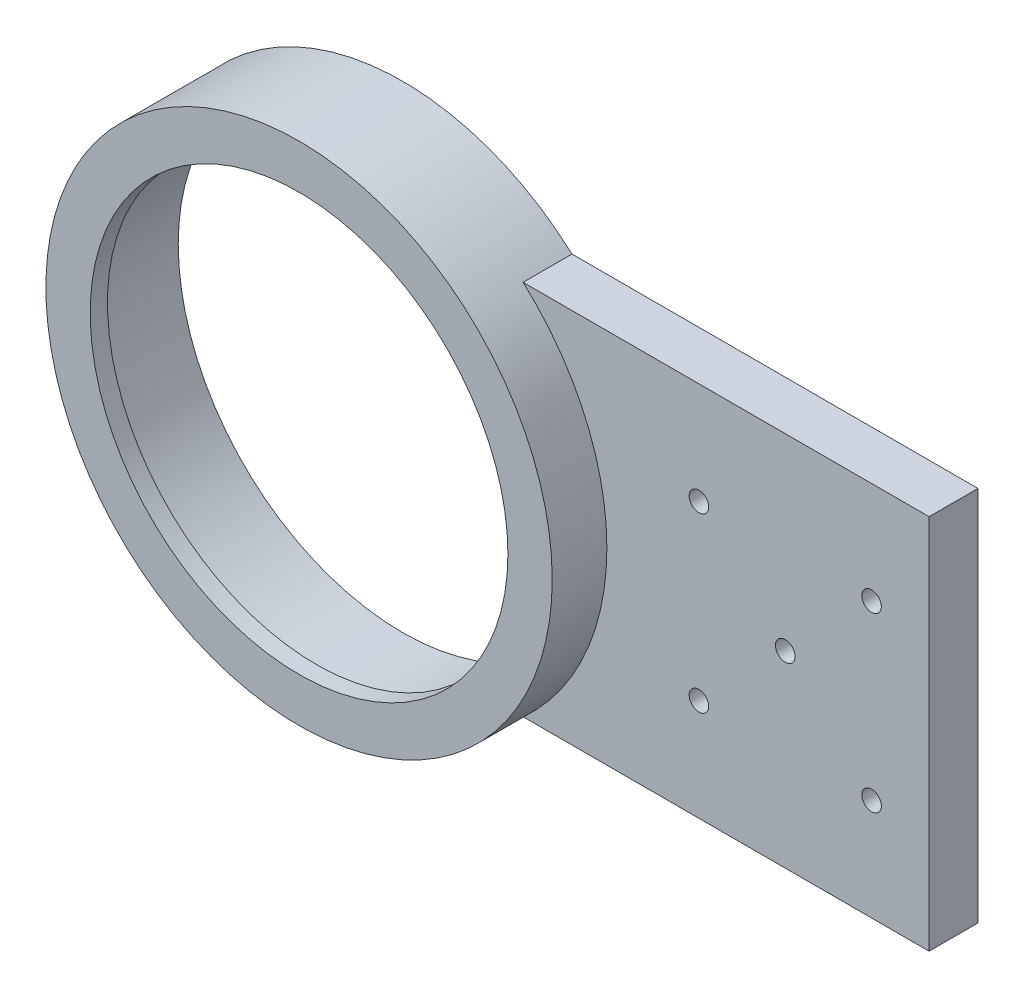
from build123d import *

# Parameters (mm, degrees)
CROQUIS1_R                   = 44
CROQUIS1_R_2                 = 36.3
SALIENTE_EXTRUIR1_DEPTH      = 3
SALIENTE_EXTRUIR2_START      = 15
CROQUIS2_R                   = 44
CROQUIS2_R_2                 = 39
SALIENTE_EXTRUIR2_DEPTH      = 15
SALIENTE_EXTRUIR3_DEPTH      = 8.5
TALADRO_DE_MARGEN_PARA_M31_D = 3.4


with BuildPart() as part:
    # Croquis1 → Saliente-Extruir1 (new body)
    with BuildSketch(Plane.XY):
        Circle(CROQUIS1_R)
        Circle(CROQUIS1_R_2, mode=Mode.SUBTRACT)
    extrude(amount=SALIENTE_EXTRUIR1_DEPTH)

    # Croquis2 → Saliente-Extruir2 (add)
    with BuildSketch(Plane(origin=(0, 0, 0), x_dir=(-1, 0, 0), z_dir=(0, 0, -1)).offset(SALIENTE_EXTRUIR2_START)):
        Circle(CROQUIS2_R)
        Circle(CROQUIS2_R_2, mode=Mode.SUBTRACT)
    extrude(amount=-SALIENTE_EXTRUIR2_DEPTH)

    # Croquis3 → Saliente-Extruir3 (add)
    with BuildSketch(Plane(origin=(0, 0, -15), x_dir=(-1, 0, 0), z_dir=(0, 0, -1))):
        with BuildLine():
            Line((-29.439938859, 32.7), (-100, 32.7))
            Line((-100, 32.7), (-100, -32.7))
            Line((-100, -32.7), (-29.439938859, -32.7))
            ThreePointArc((-29.439938859, -32.7), (-44, 0), (-29.439938859, 32.7))
        make_face()
    extrude(amount=-SALIENTE_EXTRUIR3_DEPTH)

    # Taladro de margen para M31 (through all)
    with Locations(Plane(origin=(0, 0, -15), x_dir=(-1, 0, 0), z_dir=(0, 0, -1))):
        with Locations((-75, 0), (-90, 15), (-60, -15), (-60, 15), (-90, -15)):
            Hole(TALADRO_DE_MARGEN_PARA_M31_D / 2)


solid = part.part
